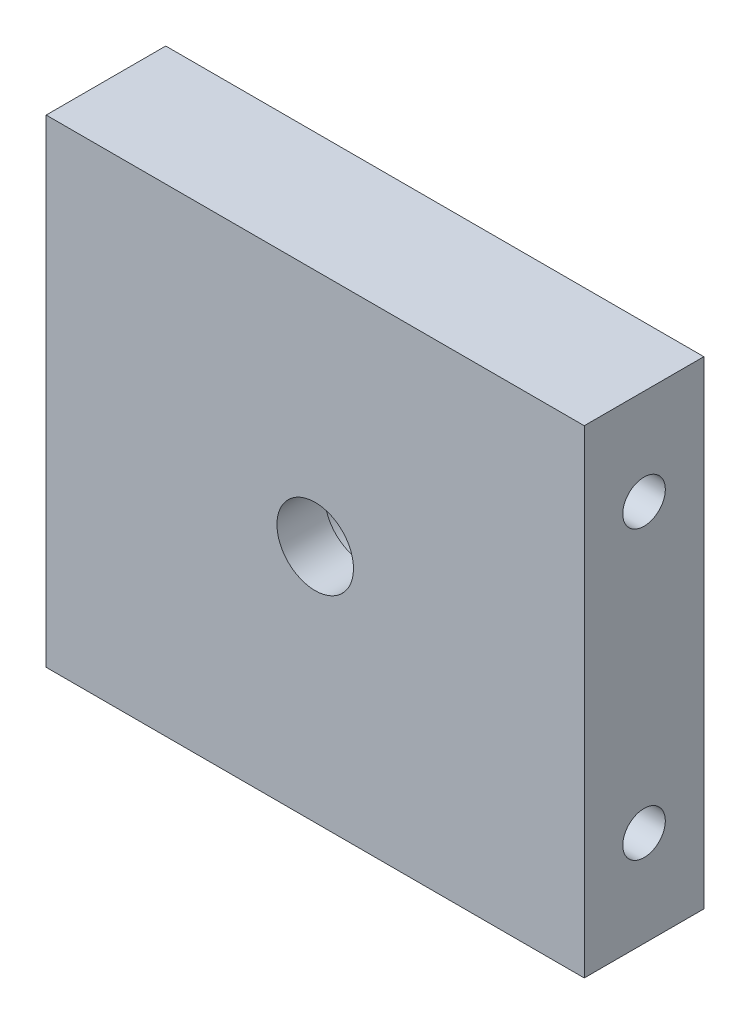
from build123d import *

# Parameters (mm, degrees)
SKETCH2_W                 = 28.575
SKETCH2_H                 = 25.4
BOSS_EXTRUDE1_DEPTH       = 6.35
F_4_40_TAPPED_HOLE2_D     = 2.2606
F_4_40_TAPPED_HOLE2_DEPTH = 7.62
F_4_40_TAPPED_HOLE2_TIP   = 0.679152758
F_4_40_TAPPED_HOLE1_D     = 2.2606
F_4_40_TAPPED_HOLE1_DEPTH = 7.62
F_4_40_TAPPED_HOLE1_TIP   = 0.679152758
SKETCH7_R                 = 2.032
CUT_EXTRUDE1_DEPTH        = 2.54
SKETCH12_R                = 3.048
CUT_EXTRUDE2_DEPTH        = 3.81


with BuildPart() as part:
    # Sketch2 → Boss-Extrude1 (new body)
    with BuildSketch(Plane.XY):
        Rectangle(SKETCH2_W, SKETCH2_H)
    extrude(amount=BOSS_EXTRUDE1_DEPTH)

    # #4-40 Tapped Hole2
    with Locations(Plane(origin=(14.2875, 0, 0), x_dir=(0, 0, -1), z_dir=(1, 0, 0))):
        with Locations((-3.175, 7.62), (-3.175, -7.62)):
            Hole(F_4_40_TAPPED_HOLE2_D / 2, depth=F_4_40_TAPPED_HOLE2_DEPTH)
            with Locations((0, 0, -(F_4_40_TAPPED_HOLE2_DEPTH + F_4_40_TAPPED_HOLE2_TIP / 2))):  # 118° drill point
                Cone(0, F_4_40_TAPPED_HOLE2_D / 2, F_4_40_TAPPED_HOLE2_TIP, mode=Mode.SUBTRACT)

    # #4-40 Tapped Hole1
    with Locations(Plane.ZY.offset(14.2875)):
        with Locations((3.175, 7.62), (3.175, -7.62)):
            Hole(F_4_40_TAPPED_HOLE1_D / 2, depth=F_4_40_TAPPED_HOLE1_DEPTH)
            with Locations((0, 0, -(F_4_40_TAPPED_HOLE1_DEPTH + F_4_40_TAPPED_HOLE1_TIP / 2))):  # 118° drill point
                Cone(0, F_4_40_TAPPED_HOLE1_D / 2, F_4_40_TAPPED_HOLE1_TIP, mode=Mode.SUBTRACT)

    # Sketch7 → Cut-Extrude1 (cut)
    with BuildSketch(Plane.XY.offset(6.35)):
        Circle(SKETCH7_R)
    extrude(amount=-CUT_EXTRUDE1_DEPTH, mode=Mode.SUBTRACT)

    # Sketch12 → Cut-Extrude2 (cut)
    with BuildSketch(Plane(origin=(0, 0, 0), x_dir=(-1, 0, 0), z_dir=(0, 0, -1))):
        Circle(SKETCH12_R)
    extrude(amount=-CUT_EXTRUDE2_DEPTH, mode=Mode.SUBTRACT)


solid = part.part
